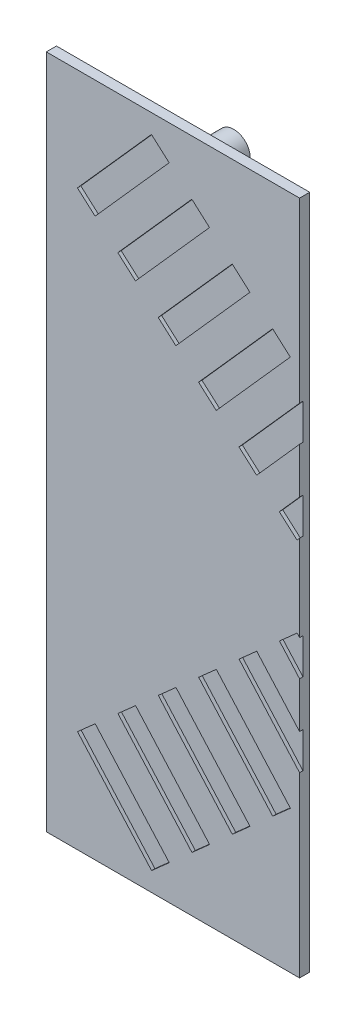
from build123d import *

# Parameters (mm, degrees)
SKETCH1_W           = 225
SKETCH1_H           = 200
BOSS_EXTRUDE1_DEPTH = 3
CUT_EXTRUDE1_DEPTH  = 1
SKETCH4_R           = 4.9
BOSS_EXTRUDE2_DEPTH = 10
SKETCH5_W           = 150
SKETCH5_H           = 200
CUT_EXTRUDE2_DEPTH  = 10


with BuildPart() as part:
    # Sketch1 → Boss-Extrude1 (new body)
    with BuildSketch(Plane.XY):
        with Locations((112.5, 100)):
            Rectangle(SKETCH1_W, SKETCH1_H)
    extrude(amount=BOSS_EXTRUDE1_DEPTH)

    # Sketch2 → Cut-Extrude1 (cut)
    with BuildSketch(Plane.XY.offset(3)):
        Polygon((21.176597363, 159.100101172), (43.100604044, 183.764608689), (48.332469275, 179.114061817), (26.408462593, 154.4495543), align=None)
        Polygon((9.218048264, 169.729922593), (31.142054945, 194.39443011), (36.373920176, 189.743883238), (14.449913495, 165.079375722), align=None)
        Polygon((33.135146462, 148.470279751), (55.059153143, 173.134787267), (60.291018374, 168.484240396), (38.367011692, 143.819732879), align=None)
        Polygon((45.093695561, 137.840458329), (67.017702242, 162.504965846), (72.249567473, 157.854418974), (50.325560791, 133.189911458), align=None)
        Polygon((57.05224466, 127.210636908), (78.976251341, 151.875144425), (84.208116572, 147.224597553), (62.28410989, 122.560090036), align=None)
        Polygon((69.010793758, 116.580815487), (90.93480044, 141.245323003), (96.166665671, 136.594776132), (74.242658989, 111.930268615), align=None)
        Polygon((80.969342857, 105.950994066), (102.893349539, 130.615501582), (108.12521477, 125.96495471), (86.201208088, 101.300447194), align=None)
        Polygon((116.844990154, 74.061529802), (138.768996836, 98.726037318), (144.000862066, 94.075490447), (122.076855385, 69.41098293), align=None)
        Polygon((128.803539253, 63.431708381), (150.727545935, 88.096215897), (155.959411165, 83.445669025), (134.035404484, 58.781161509), align=None)
        Polygon((140.762088352, 52.801886959), (162.686095033, 77.466394476), (167.917960264, 72.815847604), (145.993953583, 48.151340087), align=None)
        Polygon((152.720637451, 42.172065538), (174.644644132, 66.836573055), (179.876509363, 62.186026183), (157.952502682, 37.521518666), align=None)
        Polygon((164.67918655, 31.542244117), (186.603193231, 56.206751633), (191.835058462, 51.556204761), (169.911051781, 26.891697245), align=None)
        Polygon((176.637735649, 20.912422695), (198.56174233, 45.576930212), (203.793607561, 40.92638334), (181.86960088, 16.261875824), align=None)
        Polygon((188.596284748, 10.282601274), (210.520291429, 34.947108791), (215.75215666, 30.296561919), (193.828149979, 5.632054402), align=None)
        Polygon((198.591537407, 154.4495543), (176.667530725, 179.114061817), (181.899395956, 183.764608689), (203.823402637, 159.100101172), align=None)
        Polygon((210.550086505, 165.079375721), (188.626079824, 189.743883238), (193.857945055, 194.39443011), (215.781951736, 169.729922593), align=None)
        Polygon((186.632988308, 143.819732879), (164.708981626, 168.484240395), (169.940846857, 173.134787267), (191.864853538, 148.470279751), align=None)
        Polygon((174.674439209, 133.189911458), (152.750432527, 157.854418974), (157.982297758, 162.504965846), (179.906304439, 137.840458329), align=None)
        Polygon((162.71589011, 122.560090036), (140.791883428, 147.224597553), (146.023748659, 151.875144425), (167.94775534, 127.210636908), align=None)
        Polygon((150.757341011, 111.930268615), (128.833334329, 136.594776132), (134.06519956, 141.245323003), (155.989206242, 116.580815487), align=None)
        Polygon((138.798791912, 101.300447194), (116.87478523, 125.96495471), (122.106650461, 130.615501582), (144.030657143, 105.950994066), align=None)
        Polygon((102.923144615, 69.41098293), (80.999137934, 94.075490447), (86.231003164, 98.726037318), (108.155009846, 74.061529802), align=None)
        Polygon((90.964595516, 58.781161509), (69.040588835, 83.445669025), (74.272454065, 88.096215897), (96.196460747, 63.431708381), align=None)
        Polygon((79.006046417, 48.151340087), (57.082039736, 72.815847604), (62.313904967, 77.466394476), (84.237911648, 52.801886959), align=None)
        Polygon((67.047497318, 37.521518666), (45.123490637, 62.186026183), (50.355355868, 66.836573055), (72.279362549, 42.172065538), align=None)
        Polygon((55.088948219, 26.891697245), (33.164941538, 51.556204761), (38.396806769, 56.206751633), (60.32081345, 31.542244117), align=None)
        Polygon((43.13039912, 16.261875824), (21.206392439, 40.92638334), (26.43825767, 45.576930212), (48.362264351, 20.912422695), align=None)
        Polygon((31.171850021, 5.632054402), (9.24784334, 30.296561919), (14.479708571, 34.947108791), (36.403715252, 10.282601274), align=None)
    extrude(amount=-CUT_EXTRUDE1_DEPTH, mode=Mode.SUBTRACT)

    # Sketch4 → Boss-Extrude2 (add)
    with BuildSketch(Plane(origin=(0, 0, 0), x_dir=(-1, 0, 0), z_dir=(0, 0, -1))):
        with Locations((-42.5, 190)):
            Circle(SKETCH4_R)
        with Locations((-22.5, 10)):
            Circle(SKETCH4_R)
    extrude(amount=BOSS_EXTRUDE2_DEPTH)

    # Sketch5 → Cut-Extrude2 (cut)
    with BuildSketch(Plane(origin=(0, 0, 0), x_dir=(-1, 0, 0), z_dir=(0, 0, -1))):
        with Locations((-150, 100)):
            Rectangle(SKETCH5_W, SKETCH5_H)
    extrude(amount=-CUT_EXTRUDE2_DEPTH, mode=Mode.SUBTRACT)


solid = part.part
